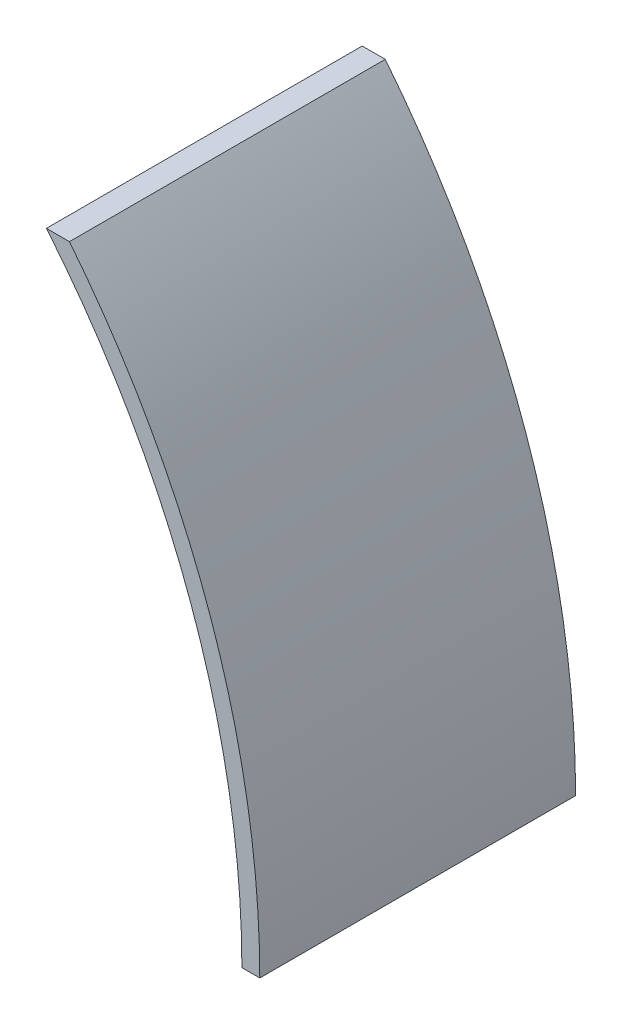
from build123d import *

# Parameters (mm, degrees)
BOSS_EXTRUDE2_DEPTH = 810.26


with BuildPart() as part:
    # Sketch1 → Boss-Extrude2 (new body)
    with BuildSketch(Plane.XY):
        with BuildLine():
            Line((59.131767116, 0), (0, 0))
            ThreePointArc((0, 0), (372.098907579, -652.282138403), (501.586016125, -1391.986588722))
            Line((501.586016125, -1391.986588722), (547.472614707, -1391.986588722))
            ThreePointArc((547.472614707, -1391.986588722), (421.586831022, -654.496327453), (59.131767116, 0))
        make_face()
    extrude(amount=BOSS_EXTRUDE2_DEPTH)


solid = part.part
